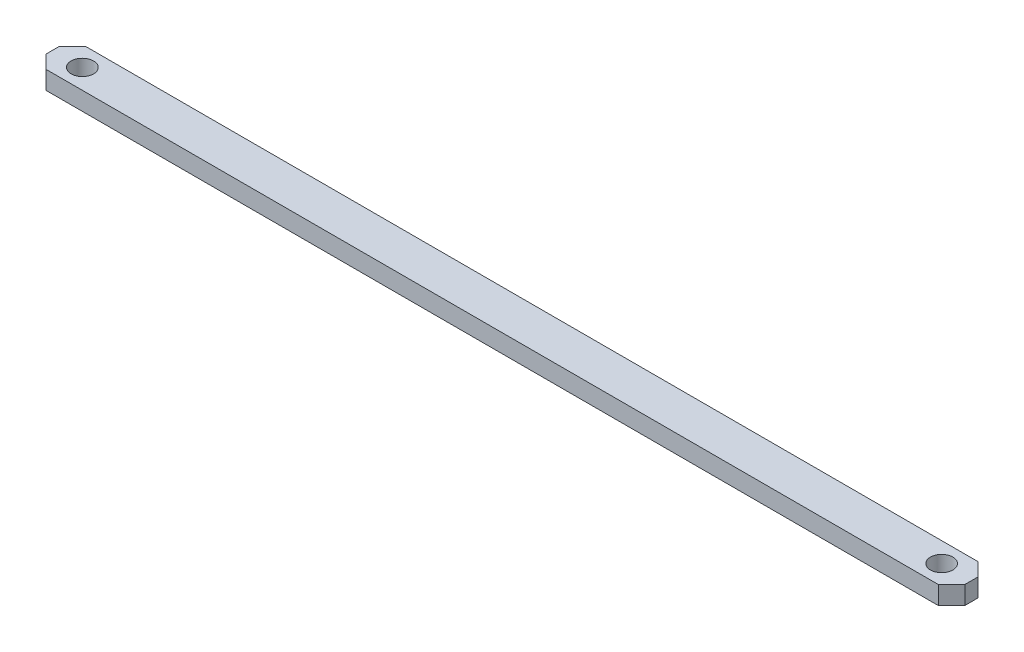
from build123d import *

# Parameters (mm, degrees)
SKETCH1_W               = 139
SKETCH1_H               = 6
BOSS_EXTRUDE1_DEPTH     = 1.38
CUT_EXTRUDE4_DEPTH      = 70.619448432
CUT_EXTRUDE4_DEPTH_BACK = 70.619448432
SKETCH8_R               = 1.7
CHAMFER2_SIZE           = 2


with BuildPart() as part:
    # Sketch1 → Boss-Extrude1 (new, symmetric)
    with BuildSketch(Plane(origin=(0, 0, 0), x_dir=(1, 0, 0), z_dir=(0, 1, 0))):
        Rectangle(SKETCH1_W, SKETCH1_H)
    extrude(amount=BOSS_EXTRUDE1_DEPTH, both=True)

    # Sketch8 → Cut-Extrude4 (cut, two sides: drawn at the far end of the back side and taken through both)
    with BuildSketch(Plane(origin=(0, 1.38, 0), x_dir=(1, 0, 0), z_dir=(0, 1, 0)).offset(-CUT_EXTRUDE4_DEPTH_BACK)):
        with Locations(Location((65, 0, 0), (0, 0, 270))):
            Circle(SKETCH8_R)
        with Locations(Location((-65, 0, 0), (0, 0, 270))):
            Circle(SKETCH8_R)
    extrude(amount=CUT_EXTRUDE4_DEPTH + CUT_EXTRUDE4_DEPTH_BACK, mode=Mode.SUBTRACT)

    # Chamfer2
    chamfer2_edges = [part.edges().sort_by_distance(p)[0] for p in [
        (69.5, 0, 3),
        (-69.5, 0, 3),
        (-69.5, 0, -3),
        (69.5, 0, -3),
    ]]
    chamfer(chamfer2_edges, length=CHAMFER2_SIZE)


solid = part.part
